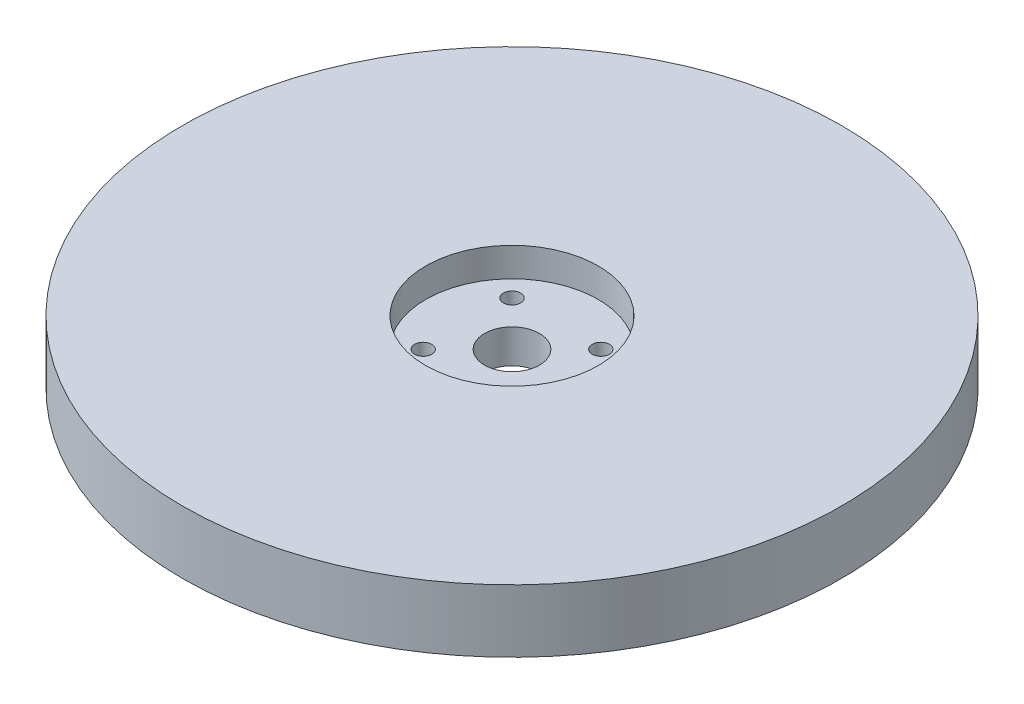
from build123d import *

# Parameters (mm, degrees)
SCHIZZO1_R                   = 42
ESTRUSIONE_ESTRUSIONE1_DEPTH = 8
SCHIZZO2_R                   = 3.5
TAGLIO_ESTRUSIONE1_DEPTH     = 60.933296255
SCHIZZO4_R                   = 11
TAGLIO_ESTRUSIONE2_DEPTH     = 3.7
SCHIZZO5_R                   = 1.1
TAGLIO_ESTRUSIONE3_DEPTH     = 3
SCHIZZO6_R                   = 1.25
TAGLIO_ESTRUSIONE4_DEPTH     = 6


with BuildPart() as part:
    # Schizzo1 → Estrusione-Estrusione1 (new body)
    with BuildSketch(Plane(origin=(0, 0, 0), x_dir=(1, 0, 0), z_dir=(0, 1, 0))):
        with Locations(Location((0, 0, 0), (0, 0, 270))):
            Circle(SCHIZZO1_R)
    extrude(amount=ESTRUSIONE_ESTRUSIONE1_DEPTH)

    # Schizzo2 → Taglio-Estrusione1 (cut, through all)
    with BuildSketch(Plane.XZ):
        with Locations(Location((0, 0, 0), (0, 0, 270))):
            Circle(SCHIZZO2_R)
    extrude(amount=-TAGLIO_ESTRUSIONE1_DEPTH, mode=Mode.SUBTRACT)

    # Schizzo4 → Taglio-Estrusione2 (cut)
    with BuildSketch(Plane(origin=(0, 8, 0), x_dir=(1, 0, 0), z_dir=(0, 1, 0))):
        with Locations(Location((0, 0, 0), (0, 0, 270))):
            Circle(SCHIZZO4_R)
    extrude(amount=-TAGLIO_ESTRUSIONE2_DEPTH, mode=Mode.SUBTRACT)

    # Schizzo5 → Taglio-Estrusione3 (cut)
    with BuildSketch(Plane(origin=(0, 4.3, 0), x_dir=(1, 0, 0), z_dir=(0, 1, 0))):
        with Locations(Location((-5.66, 5.66, 0), (0, 0, 270))):
            Circle(SCHIZZO5_R)
        with Locations(Location((5.66, 5.66, 0), (0, 0, 270))):
            Circle(SCHIZZO5_R)
        with Locations(Location((5.66, -5.66, 0), (0, 0, 270))):
            Circle(SCHIZZO5_R)
        with Locations(Location((-5.66, -5.66, 0), (0, 0, 270))):
            Circle(SCHIZZO5_R)
    extrude(amount=-TAGLIO_ESTRUSIONE3_DEPTH, mode=Mode.SUBTRACT)

    # Schizzo6 → Taglio-Estrusione4 (cut)
    with BuildSketch(Plane.XZ):
        with Locations(Location((12, 12, 0), (0, 0, 270))):
            Circle(SCHIZZO6_R)
        with Locations(Location((12, -12, 0), (0, 0, 90))):
            Circle(SCHIZZO6_R)
        with Locations(Location((-24, 12, 0), (0, 0, 270))):
            Circle(SCHIZZO6_R)
        with Locations(Location((-24, -12, 0), (0, 0, 90))):
            Circle(SCHIZZO6_R)
    extrude(amount=-TAGLIO_ESTRUSIONE4_DEPTH, mode=Mode.SUBTRACT)


solid = part.part
